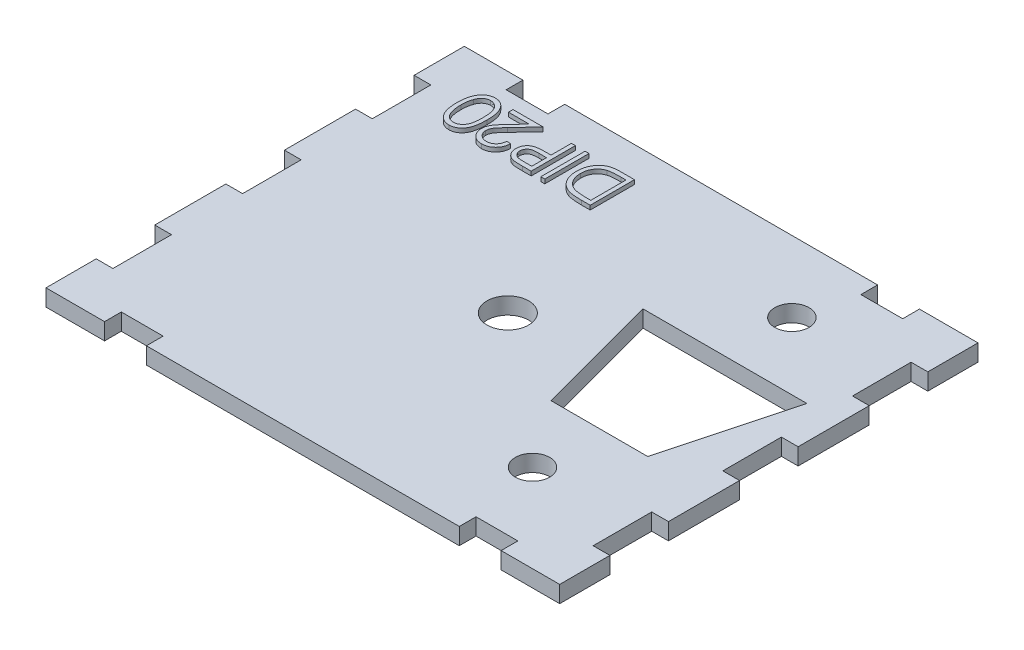
from build123d import *

# Parameters (mm, degrees)
SKETCH2_W           = 100
SKETCH2_H           = 50
BOSS_EXTRUDE1_DEPTH = 2
SKETCH12_W          = 9.8
SKETCH12_H          = 50
SKETCH12_W_2        = 8.8
CUT_EXTRUDE8_DEPTH  = 6
SKETCH13_W          = 2
SKETCH13_H          = 7
SKETCH13_W_2        = 5
SKETCH13_H_2        = 2
CUT_EXTRUDE10_DEPTH = 6
SKETCH15_W          = 6.543059906
SKETCH15_H          = 1
CUT_EXTRUDE13_DEPTH = 10
SKETCH16_R          = 2.5
CUT_EXTRUDE14_DEPTH = 10
SKETCH17_R          = 2.05
CUT_EXTRUDE15_DEPTH = 3.5
SKETCH22_W          = 0.474893162
SKETCH22_H          = 5.291666666
BOSS_EXTRUDE4_DEPTH = 0.5


with BuildPart() as part:
    # Sketch2 → Boss-Extrude1 (new body)
    with BuildSketch(Plane(origin=(0, 0, 0), x_dir=(1, 0, 0), z_dir=(0, 1, 0))):
        Rectangle(SKETCH2_W, SKETCH2_H)
    extrude(amount=BOSS_EXTRUDE1_DEPTH)

    # Sketch12 → Cut-Extrude8 (cut)
    with BuildSketch(Plane(origin=(0, 2, 0), x_dir=(1, 0, 0), z_dir=(0, 1, 0))):
        with Locations((-45.1, 0)):
            Rectangle(SKETCH12_W, SKETCH12_H)
        with Locations((45.6, 0)):
            Rectangle(SKETCH12_W_2, SKETCH12_H)
    extrude(amount=-CUT_EXTRUDE8_DEPTH, mode=Mode.SUBTRACT)

    # Sketch13 → Cut-Extrude10 (cut)
    with BuildSketch(Plane(origin=(0, 2, 0), x_dir=(1, 0, 0), z_dir=(0, 1, 0))):
        with Locations((-29.2, 0)):
            Rectangle(SKETCH13_W, SKETCH13_H)
        Polygon((-30.2, 12), (-30.2, 19), (-30.2, 25), (-40.2, 25), (-40.2, -25), (-30.2, -25), (-30.2, -19), (-30.2, -12), (-30.2, -3.5), (-30.2, 3.5), align=None)
        with Locations((-29.2, 15.5)):
            Rectangle(SKETCH13_W, SKETCH13_H)
        with Locations((21.7, -24)):
            Rectangle(SKETCH13_W_2, SKETCH13_H_2)
        with Locations((30.2, -15.5)):
            Rectangle(SKETCH13_W, SKETCH13_H)
        with Locations((30.2, 0)):
            Rectangle(SKETCH13_W, SKETCH13_H)
        with Locations((30.2, 15.5)):
            Rectangle(SKETCH13_W, SKETCH13_H)
        with Locations((21.7, 24)):
            Rectangle(SKETCH13_W_2, SKETCH13_H_2)
        with Locations((-29.2, -15.5)):
            Rectangle(SKETCH13_W, SKETCH13_H)
        Polygon((41.2, 25), (31.2, 25), (31.2, 19), (31.2, 12), (31.2, 3.5), (31.2, -3.5), (31.2, -12), (31.2, -19), (31.2, -25), (41.2, -25), align=None)
        with Locations((-20.7, 24)):
            Rectangle(SKETCH13_W_2, SKETCH13_H_2)
        with Locations((-20.7, -24)):
            Rectangle(SKETCH13_W_2, SKETCH13_H_2)
    extrude(amount=-CUT_EXTRUDE10_DEPTH, mode=Mode.SUBTRACT)

    # Sketch15 → Cut-Extrude13 (cut)
    with BuildSketch(Plane.XZ):
        Polygon((8.96933351, -7.5), (14.181143059, -7.5), (20.724202965, -7.5), (25.936012514, -7.5), (22.452673012, 5.5), (12.452673012, 5.5), align=None)
        Polygon((27.239237886, -8.5), (20.724202965, -8.5), (20.724202965, -7.5), (25.936012514, -7.5), (22.452673012, 5.5), (12.452673012, 5.5), (8.96933351, -7.5), (14.181143059, -7.5), (14.181143059, -8.5), (7.666108138, -8.5), (11.685346024, 6.5), (23.22, 6.5), align=None)
        with Locations((17.452673012, -8)):
            Rectangle(SKETCH15_W, SKETCH15_H)
    extrude(amount=-CUT_EXTRUDE13_DEPTH, mode=Mode.SUBTRACT)

    # Sketch16 → Cut-Extrude14 (cut)
    with BuildSketch(Plane(origin=(0, 0, 0), x_dir=(-1, 0, 0), z_dir=(0, -1, 0))):
        with Locations(Location((0, 0, 0), (0, 0, 90))):
            Circle(SKETCH16_R)
    extrude(amount=-CUT_EXTRUDE14_DEPTH, mode=Mode.SUBTRACT)

    # Sketch17 → Cut-Extrude15 (cut)
    with BuildSketch(Plane(origin=(0, 0, 0), x_dir=(-1, 0, 0), z_dir=(0, -1, 0))):
        with Locations(Location((-17.452672874, -14.5, 0), (0, 0, 90))):
            Circle(SKETCH17_R)
        with Locations(Location((-17.452672903, 16.5, 0), (0, 0, 90))):
            Circle(SKETCH17_R)
    extrude(amount=-CUT_EXTRUDE15_DEPTH, mode=Mode.SUBTRACT)

    # Sketch22 → Boss-Extrude4 (add)
    # profile 1 of 5: a face of its own
    with BuildSketch(Plane(origin=(0, 2, 0), x_dir=(1, 0, 0), z_dir=(0, 1, 0))):
        with BuildLine():
            add(Edge.make_bspline(
                [(-20.716744497, 18.218426666), (-20.717240429, 18.133612758), (-20.718203785, 17.96886052), (-20.728920802, 17.728793264), (-20.746723997, 17.503579492), (-20.771122173, 17.293208433), (-20.800812912, 17.097625749), (-20.840448286, 16.917354204), (-20.88552222, 16.751559148), (-20.937762848, 16.599700925), (-20.996706535, 16.45973023), (-21.060870631, 16.329070697), (-21.132757353, 16.207878408), (-21.208413198, 16.094367743), (-21.290485981, 15.989681037), (-21.378690291, 15.894288773), (-21.47224922, 15.806712705), (-21.571605461, 15.728392909), (-21.675812025, 15.660147655), (-21.781786347, 15.598284876), (-21.892551031, 15.549349711), (-22.005374005, 15.507504508), (-22.12116426, 15.474357453), (-22.239972236, 15.451301074), (-22.361904547, 15.436876513), (-22.444198293, 15.43549178), (-22.485933533, 15.434789513)],
                knots=[0, 0, 0, 0, 1.64625301, 3.197870201, 4.6634513, 6.030635694, 7.308242971, 8.501545196, 9.611429483, 10.641742253, 11.616230371, 12.55791849, 13.464870342, 14.34944951, 15.20427819, 16.044004467, 16.869007726, 17.689551165, 18.496129964, 19.285613293, 20.0683943, 20.843080271, 21.620342827, 22.403213977, 23.190190624, 24, 24, 24, 24], degree=3))
            add(Edge.make_bspline(
                [(-22.485933533, 15.434789513), (-22.528038535, 15.435373486), (-22.61181267, 15.436535387), (-22.73522212, 15.45288984), (-22.856481988, 15.473999006), (-22.973752523, 15.507854633), (-23.089251084, 15.548367281), (-23.200105454, 15.601823076), (-23.310229379, 15.659960405), (-23.414620076, 15.730883055), (-23.516396548, 15.809264255), (-23.611801364, 15.898246955), (-23.703273327, 15.995368549), (-23.787357576, 16.102795134), (-23.867657845, 16.21887954), (-23.941125855, 16.34459489), (-24.009289607, 16.47966258), (-24.073430397, 16.623456458), (-24.129519825, 16.77981748), (-24.179387809, 16.947770381), (-24.220263061, 17.128836057), (-24.254066175, 17.322005856), (-24.280303826, 17.528236739), (-24.299399145, 17.747110858), (-24.309489362, 17.978765144), (-24.311389212, 18.137149085), (-24.312364155, 18.218426666)],
                knots=[0, 0, 0, 0, 0.810910589, 1.61342667, 2.396193133, 3.181089899, 3.963115317, 4.752255436, 5.550715454, 6.36105385, 7.181178335, 8.024612154, 8.872680183, 9.750181803, 10.651284446, 11.591556747, 12.554036451, 13.566402641, 14.62422919, 15.753422176, 16.94128843, 18.199818041, 19.531985927, 20.947085226, 22.433341622, 24, 24, 24, 24], degree=3))
            add(Edge.make_bspline(
                [(-24.312364155, 18.218426666), (-24.311366549, 18.299348707), (-24.309418403, 18.45737495), (-24.299628784, 18.688001941), (-24.279791944, 18.905681719), (-24.255614422, 19.110729663), (-24.220755165, 19.30287774), (-24.181946396, 19.483157858), (-24.132443633, 19.64987607), (-24.077684634, 19.804896801), (-24.014436319, 19.948081555), (-23.946785923, 20.08259173), (-23.872221202, 20.207593617), (-23.793461748, 20.324413826), (-23.707785617, 20.430919093), (-23.617551542, 20.52912711), (-23.521221151, 20.618264406), (-23.41892076, 20.697571076), (-23.313543383, 20.769027981), (-23.203397989, 20.82923831), (-23.091062981, 20.88172943), (-22.975369929, 20.923926152), (-22.857056574, 20.957282826), (-22.73569685, 20.97999021), (-22.611796166, 20.995996057), (-22.528033014, 20.997212377), (-22.485933533, 20.997823701)],
                knots=[0, 0, 0, 0, 1.561431216, 3.049195289, 4.452146966, 5.778046447, 7.031138842, 8.218704273, 9.334037798, 10.384210803, 11.388620812, 12.352076869, 13.287433199, 14.19507451, 15.06813243, 15.922055533, 16.766344942, 17.596869952, 18.417486629, 19.220035357, 20.016159057, 20.807716045, 21.59340902, 22.384936649, 23.188266813, 24, 24, 24, 24], degree=3))
            add(Edge.make_bspline(
                [(-22.485933533, 20.997823701), (-22.444199748, 20.99711521), (-22.361908869, 20.995718204), (-22.239955549, 20.981383542), (-22.121319838, 20.958008536), (-22.005764569, 20.926265399), (-21.893053284, 20.885921737), (-21.784289992, 20.834606155), (-21.678038718, 20.775087836), (-21.574782726, 20.707375471), (-21.476495962, 20.629775573), (-21.382592523, 20.543964833), (-21.295530267, 20.447731815), (-21.21402349, 20.342612472), (-21.137739906, 20.228816063), (-21.066157605, 20.106695981), (-21.002188911, 19.974763601), (-20.941908745, 19.834033066), (-20.888771319, 19.681059028), (-20.842372699, 19.514695816), (-20.803254441, 19.333808679), (-20.772096202, 19.138388958), (-20.746570656, 18.928739176), (-20.728938353, 18.704525245), (-20.718209143, 18.466227411), (-20.717241621, 18.302534227), (-20.716744497, 18.218426666)],
                knots=[0, 0, 0, 0, 0.810976328, 1.599087026, 2.383086309, 3.159618043, 3.926613167, 4.707144544, 5.494386734, 6.292609454, 7.104690378, 7.92621526, 8.762510248, 9.62398222, 10.509836085, 11.424023232, 12.373226806, 13.358118208, 14.398657954, 15.5185989, 16.713620699, 17.994156382, 19.364120462, 20.818119981, 22.365111093, 24, 24, 24, 24], degree=3))
        make_face()
        with BuildLine():
            add(Edge.make_bspline(
                [(-21.191637659, 18.216306607), (-21.191822212, 18.286985905), (-21.192180392, 18.424160543), (-21.2012668, 18.623146598), (-21.213914152, 18.809052726), (-21.229825254, 18.981806364), (-21.253654372, 19.140803765), (-21.280690025, 19.286705867), (-21.313117431, 19.419242842), (-21.351674753, 19.53957213), (-21.395592975, 19.649400261), (-21.443467732, 19.751645476), (-21.495326441, 19.847551436), (-21.552358895, 19.936772111), (-21.615382206, 20.018809184), (-21.682989671, 20.094052275), (-21.755574408, 20.162195015), (-21.856031538, 20.243066641), (-21.988008519, 20.327620836), (-22.155144168, 20.40034548), (-22.326959281, 20.446343687), (-22.443609989, 20.452177047), (-22.501833973, 20.455088658)],
                knots=[0, 0, 0, 0, 1.459193451, 2.832007961, 4.111736495, 5.306635028, 6.412683014, 7.430020708, 8.369596877, 9.227877302, 10.036669781, 10.810175692, 11.557788084, 12.286326232, 12.994037279, 13.69140682, 14.37267704, 15.047194847, 16.352618509, 17.594157723, 18.799169539, 20, 20, 20, 20], degree=3))
            add(Edge.make_bspline(
                [(-22.501833973, 20.455088658), (-22.56039229, 20.452535574), (-22.677301204, 20.447438463), (-22.848999369, 20.402952882), (-23.014305724, 20.330633455), (-23.144763746, 20.248010224), (-23.243738474, 20.168821653), (-23.314678398, 20.101383625), (-23.379782473, 20.025850922), (-23.441532256, 19.944361484), (-23.498166684, 19.855351571), (-23.549666941, 19.759251103), (-23.596661992, 19.655792677), (-23.623436384, 19.583569385), (-23.63712544, 19.546643479)],
                knots=[0, 0, 0, 0, 1.353621445, 2.702441307, 4.075953605, 5.516772412, 6.261413105, 7.007624062, 7.778524365, 8.566925914, 9.372323995, 10.217594641, 11.088702136, 12, 12, 12, 12], degree=3))
            add(Edge.make_bspline(
                [(-23.63712544, 19.546643479), (-23.653078708, 19.499427087), (-23.685470683, 19.403557563), (-23.727217056, 19.254841089), (-23.760094029, 19.098808339), (-23.789671975, 18.936391793), (-23.809860524, 18.766393674), (-23.826110194, 18.589339974), (-23.83568159, 18.4050972), (-23.836868058, 18.279919059), (-23.837470993, 18.216306607)],
                knots=[0, 0, 0, 0, 0.884706709, 1.796334032, 2.740027952, 3.714592787, 4.726048262, 5.777819803, 6.87074269, 8, 8, 8, 8], degree=3))
            add(Edge.make_bspline(
                [(-23.837470993, 18.216306607), (-23.836806021, 18.152695522), (-23.835505032, 18.028243249), (-23.826957421, 17.846169461), (-23.81322212, 17.672936408), (-23.794631691, 17.50838694), (-23.769110968, 17.35281393), (-23.738463103, 17.205994778), (-23.702532053, 17.06796899), (-23.661317876, 16.938380859), (-23.614870734, 16.817695303), (-23.563558283, 16.705652528), (-23.508808846, 16.601648234), (-23.449303872, 16.506016944), (-23.385885258, 16.418200644), (-23.316275862, 16.340220811), (-23.244897219, 16.268283944), (-23.143381683, 16.187637415), (-23.01156069, 16.104759791), (-22.846399369, 16.030565501), (-22.675464524, 15.986655318), (-22.559669092, 15.980565949), (-22.501833973, 15.977524556)],
                knots=[0, 0, 0, 0, 1.313528337, 2.569860077, 3.762944266, 4.901481389, 5.988248151, 7.017139294, 7.997571128, 8.932104357, 9.823695246, 10.66607014, 11.475539426, 12.248954257, 12.990316782, 13.708962568, 14.405488541, 15.08007697, 16.381737273, 17.610043218, 18.806313575, 20, 20, 20, 20], degree=3))
            add(Edge.make_bspline(
                [(-22.501833973, 15.977524556), (-22.443295893, 15.980569547), (-22.326113091, 15.986665078), (-22.153390072, 16.030410579), (-21.987240021, 16.104232098), (-21.855696818, 16.1877399), (-21.755610415, 16.267970747), (-21.684387143, 16.336446079), (-21.617170962, 16.41098549), (-21.554449567, 16.492650604), (-21.497765085, 16.581701152), (-21.445276081, 16.676911849), (-21.397783283, 16.779005182), (-21.353699287, 16.888772612), (-21.31555108, 17.009299623), (-21.281251394, 17.141810167), (-21.254777198, 17.288661133), (-21.231270439, 17.448405185), (-21.213502001, 17.621364216), (-21.201354945, 17.807710428), (-21.192152794, 18.007390135), (-21.19181281, 18.145273012), (-21.191637659, 18.216306607)],
                knots=[0, 0, 0, 0, 1.207779899, 2.417760083, 3.652287919, 4.947299644, 5.621638849, 6.297435916, 6.984320042, 7.691843698, 8.42018894, 9.161205785, 9.934506883, 10.743085206, 11.601138371, 12.542248028, 13.566483018, 14.679455109, 15.87477181, 17.154161492, 18.533899613, 20, 20, 20, 20], degree=3))
        make_face(mode=Mode.SUBTRACT)
    # profile 2 of 5: a face of its own
    with BuildSketch(Plane(origin=(0, 2, 0), x_dir=(1, 0, 0), z_dir=(0, 1, 0))):
        with BuildLine():
            Line((-17.32465048, 17.198678402), (-16.849757317, 17.198678402))
            add(Edge.make_bspline(
                [(-16.849757317, 17.198678402), (-16.852851891, 17.135675678), (-16.858929551, 17.011940004), (-16.887403586, 16.831538016), (-16.928108647, 16.659082118), (-16.985797214, 16.496050803), (-17.057037554, 16.340496525), (-17.144256345, 16.194484864), (-17.245594226, 16.056566672), (-17.360865287, 15.929353198), (-17.485945012, 15.813064177), (-17.620083979, 15.711579967), (-17.761903493, 15.626816763), (-17.910173472, 15.555571335), (-18.066608702, 15.502157924), (-18.229713838, 15.462508642), (-18.400226098, 15.438657581), (-18.516400763, 15.436093539), (-18.575485149, 15.434789513)],
                knots=[0, 0, 0, 0, 1.100776268, 2.161895295, 3.184016182, 4.190939212, 5.176500551, 6.166955529, 7.155448256, 8.160289653, 9.16017456, 10.133824356, 11.091467644, 12.04088621, 13.000931625, 13.972173743, 14.968683325, 16, 16, 16, 16], degree=3))
            add(Edge.make_bspline(
                [(-18.575485149, 15.434789513), (-18.633513225, 15.43613687), (-18.747536322, 15.438784379), (-18.91388184, 15.461862354), (-19.072615359, 15.497227293), (-19.221937953, 15.549632562), (-19.363382093, 15.615389712), (-19.495196463, 15.697167342), (-19.620568474, 15.791096012), (-19.733345086, 15.901889483), (-19.836944009, 16.020106397), (-19.926240018, 16.146361068), (-20.003142442, 16.276912284), (-20.066084675, 16.412779842), (-20.113797686, 16.554406192), (-20.149148455, 16.700433513), (-20.169356865, 16.852547061), (-20.172441304, 16.955520649), (-20.174009454, 17.007873113)],
                knots=[0, 0, 0, 0, 1.111674182, 2.184400057, 3.212814286, 4.223731311, 5.211378316, 6.196328225, 7.191884489, 8.207283132, 9.220262353, 10.201199469, 11.166417575, 12.120932471, 13.06540007, 14.026332106, 14.996573967, 16, 16, 16, 16], degree=3))
            add(Edge.make_bspline(
                [(-20.174009454, 17.007873113), (-20.171449362, 17.081575165), (-20.166374103, 17.227685901), (-20.12296129, 17.442399313), (-20.055155392, 17.650425689), (-19.973523766, 17.817855649), (-19.891150425, 17.952755421), (-19.816994329, 18.063880067), (-19.729688646, 18.183499948), (-19.629979277, 18.312099225), (-19.516149085, 18.44799378), (-19.391155364, 18.593956229), (-19.251770107, 18.747287624), (-19.154027533, 18.85208326), (-19.10337978, 18.906385733)],
                knots=[0, 0, 0, 0, 1.184416499, 2.348048165, 3.509039915, 4.696071444, 5.333504901, 6.05069495, 6.844171097, 7.714965912, 8.667477798, 9.695072654, 10.805644396, 12, 12, 12, 12], degree=3))
            Line((-19.10337978, 18.906385733), (-17.779403084, 20.319404897))
            Line((-17.779403084, 20.319404897), (-20.241851335, 20.319404897))
            Line((-20.241851335, 20.319404897), (-20.241851335, 20.86213994))
            Line((-20.241851335, 20.86213994), (-16.646231676, 20.86213994))
            Line((-16.646231676, 20.86213994), (-18.698448557, 18.67211924))
            add(Edge.make_bspline(
                [(-18.698448557, 18.67211924), (-18.748417352, 18.619963931), (-18.84439718, 18.519784256), (-18.980093345, 18.373480687), (-19.102166364, 18.237912214), (-19.210697214, 18.112478104), (-19.305775196, 17.997889449), (-19.387096101, 17.893248245), (-19.455019352, 17.799452493), (-19.527003845, 17.689265166), (-19.595645836, 17.554573304), (-19.655975122, 17.390800765), (-19.692497651, 17.221836952), (-19.696901246, 17.107690788), (-19.699116292, 17.050274288)],
                knots=[0, 0, 0, 0, 1.329530082, 2.553755191, 3.672934919, 4.687409497, 5.60679272, 6.413407421, 7.126401618, 7.737995624, 8.834647426, 9.90044882, 10.943907757, 12, 12, 12, 12], degree=3))
            add(Edge.make_bspline(
                [(-19.699116292, 17.050274288), (-19.698164983, 17.014163899), (-19.696290137, 16.942997254), (-19.679430288, 16.838724367), (-19.654659824, 16.737751005), (-19.616480887, 16.641325632), (-19.5706103, 16.547551747), (-19.512007243, 16.459280369), (-19.445039337, 16.373502538), (-19.367359852, 16.293159506), (-19.28208221, 16.219552812), (-19.191978454, 16.154354698), (-19.096653465, 16.099866631), (-18.996504504, 16.055199774), (-18.891812005, 16.020160778), (-18.782373149, 15.995881743), (-18.668490414, 15.980637985), (-18.590727867, 15.978575488), (-18.551104473, 15.977524556)],
                knots=[0, 0, 0, 0, 0.991504627, 1.954065223, 2.895985987, 3.842598665, 4.797835564, 5.759220273, 6.74786863, 7.784730864, 8.824135544, 9.839918996, 10.835834653, 11.835434876, 12.84861661, 13.863796685, 14.911511676, 16, 16, 16, 16], degree=3))
            add(Edge.make_bspline(
                [(-18.551104473, 15.977524556), (-18.50971181, 15.978562631), (-18.428423454, 15.980601241), (-18.309330619, 15.996052214), (-18.194924754, 16.019451925), (-18.086968824, 16.056704074), (-17.983203502, 16.100302847), (-17.886275893, 16.15675559), (-17.79346318, 16.221261578), (-17.706631391, 16.296471463), (-17.627546394, 16.381372095), (-17.555602065, 16.473784933), (-17.494642922, 16.575348268), (-17.440530105, 16.683625061), (-17.399144484, 16.801590119), (-17.363762743, 16.926358466), (-17.33806196, 17.059710251), (-17.329195224, 17.151586311), (-17.32465048, 17.198678402)],
                knots=[0, 0, 0, 0, 1.031072318, 2.024855787, 2.988461151, 3.935103592, 4.865765533, 5.788564469, 6.724086513, 7.67908574, 8.64457978, 9.611397706, 10.591395687, 11.591555111, 12.622101007, 13.700900657, 14.821571223, 16, 16, 16, 16], degree=3))
        make_face()
    # profile 3 of 5: a face of its own
    with BuildSketch(Plane(origin=(0, 2, 0), x_dir=(1, 0, 0), z_dir=(0, 1, 0))):
        with BuildLine():
            Line((-12.779244497, 15.570473274), (-13.81701326, 15.570473274))
            add(Edge.make_bspline(
                [(-13.81701326, 15.570473274), (-13.888391654, 15.570551736), (-14.025155827, 15.570702073), (-14.221272637, 15.575260081), (-14.399389731, 15.581348056), (-14.559123045, 15.589787347), (-14.700964051, 15.599760763), (-14.82427092, 15.613748966), (-14.930012869, 15.628354413), (-14.993371429, 15.643203444), (-15.022266666, 15.649975477)],
                knots=[0, 0, 0, 0, 1.415646017, 2.712440637, 3.8905458, 4.950247383, 5.884950622, 6.709939814, 7.411656543, 8, 8, 8, 8], degree=3))
            add(Edge.make_bspline(
                [(-15.022266666, 15.649975477), (-15.058844752, 15.659987537), (-15.131139009, 15.679775734), (-15.235314186, 15.719404017), (-15.334412874, 15.766413516), (-15.428849594, 15.819911156), (-15.517006538, 15.882423347), (-15.601636135, 15.950342098), (-15.68096358, 16.026414205), (-15.753791054, 16.110539513), (-15.821268853, 16.199962107), (-15.877752607, 16.296962218), (-15.927629985, 16.398174872), (-15.966499879, 16.506071206), (-15.99705311, 16.619227004), (-16.019305061, 16.737936774), (-16.033606865, 16.861944432), (-16.034963926, 16.946704527), (-16.035654753, 16.989852614)],
                knots=[0, 0, 0, 0, 0.999333726, 1.975119402, 2.933498163, 3.889020618, 4.832249799, 5.779334906, 6.747801194, 7.724875447, 8.710438469, 9.696133548, 10.679360639, 11.681339199, 12.714023775, 13.766351759, 14.862936069, 16, 16, 16, 16], degree=3))
            add(Edge.make_bspline(
                [(-16.035654753, 16.989852614), (-16.035017599, 17.033361872), (-16.033770964, 17.118490673), (-16.018808723, 17.243030484), (-15.998654743, 17.362045193), (-15.967665152, 17.475270909), (-15.927077051, 17.582035229), (-15.879464067, 17.683969711), (-15.822036586, 17.779340167), (-15.75604976, 17.868492833), (-15.682644374, 17.951511391), (-15.602131003, 18.027794235), (-15.514834691, 18.096894842), (-15.421032872, 18.158968123), (-15.319811077, 18.212574641), (-15.212704488, 18.260588662), (-15.098782137, 18.300912765), (-15.019947622, 18.322124882), (-14.979865491, 18.332909839)],
                knots=[0, 0, 0, 0, 1.121902311, 2.195077645, 3.232258892, 4.234102512, 5.217864754, 6.176164875, 7.132989551, 8.084763148, 9.034132444, 9.988522005, 10.94243251, 11.903244335, 12.886203696, 13.894208494, 14.929344452, 16, 16, 16, 16], degree=3))
            add(Edge.make_bspline(
                [(-14.979865491, 18.332909839), (-14.946713072, 18.339954568), (-14.87405762, 18.355393501), (-14.754408864, 18.37274643), (-14.615031471, 18.386977728), (-14.456399664, 18.400258489), (-14.278143518, 18.407295632), (-14.080671866, 18.415558386), (-13.863316399, 18.419457128), (-13.711717737, 18.419703577), (-13.632568148, 18.419832248)],
                knots=[0, 0, 0, 0, 0.601372724, 1.317943291, 2.144091499, 3.08771165, 4.142394186, 5.309582461, 6.595334295, 8, 8, 8, 8], degree=3))
            Line((-13.632568148, 18.419832248), (-13.254137659, 18.419832248))
            Line((-13.254137659, 18.419832248), (-13.254137659, 20.86213994))
            Line((-13.254137659, 20.86213994), (-12.779244497, 20.86213994))
            Line((-12.779244497, 20.86213994), (-12.779244497, 15.570473274))
        make_face()
        with BuildLine():
            Line((-13.254137659, 16.113208316), (-13.254137659, 17.877097205))
            Line((-13.254137659, 17.877097205), (-14.180603338, 17.888757528))
            add(Edge.make_bspline(
                [(-14.180603338, 17.888757528), (-14.225840178, 17.888787356), (-14.313168964, 17.888844938), (-14.439658695, 17.88271634), (-14.556729458, 17.876049117), (-14.664554104, 17.865266634), (-14.762640492, 17.852115365), (-14.851226102, 17.834532053), (-14.931017891, 17.81659821), (-15.022929194, 17.785479811), (-15.125879494, 17.738533756), (-15.237617027, 17.66841397), (-15.333087585, 17.580080672), (-15.415005911, 17.479688961), (-15.479756752, 17.367889769), (-15.526684494, 17.248603261), (-15.555328213, 17.122282387), (-15.558928486, 17.03593638), (-15.560761591, 16.991972673)],
                knots=[0, 0, 0, 0, 1.160501667, 2.240324542, 3.248665471, 4.168823117, 5.020172044, 5.786515869, 6.485785279, 7.116517804, 8.272762037, 9.381837012, 10.485674779, 11.594342068, 12.695271952, 13.786226926, 14.872841088, 16, 16, 16, 16], degree=3))
            add(Edge.make_bspline(
                [(-15.560761591, 16.991972673), (-15.558846703, 16.949433268), (-15.555040144, 16.864870196), (-15.526921101, 16.740876728), (-15.479259773, 16.622946321), (-15.414953123, 16.512033242), (-15.334997849, 16.411908358), (-15.241426001, 16.325543685), (-15.135693414, 16.255641595), (-15.03810663, 16.209108439), (-14.950774144, 16.181820361), (-14.875283153, 16.16211975), (-14.789612426, 16.148532658), (-14.694572728, 16.135532366), (-14.590285742, 16.125038301), (-14.47608833, 16.117750887), (-14.352360878, 16.113530682), (-14.266469108, 16.113318373), (-14.221944484, 16.113208316)],
                knots=[0, 0, 0, 0, 1.12039168, 2.227199994, 3.330242575, 4.460839274, 5.593542475, 6.693949254, 7.801736126, 8.92216649, 9.528704869, 10.210659466, 10.975987387, 11.81211542, 12.738540127, 13.736887663, 14.826846554, 16, 16, 16, 16], degree=3))
            Line((-14.221944484, 16.113208316), (-13.254137659, 16.113208316))
        make_face(mode=Mode.SUBTRACT)
    # profile 4 of 5: a face of its own
    with BuildSketch(Plane(origin=(0, 2, 0), x_dir=(1, 0, 0), z_dir=(0, 1, 0))):
        with Locations((-11.38848595, 18.216306607)):
            Rectangle(SKETCH22_W, SKETCH22_H)
    # profile 5 of 5: a face of its own
    with BuildSketch(Plane(origin=(0, 2, 0), x_dir=(1, 0, 0), z_dir=(0, 1, 0))):
        with BuildLine():
            Line((-5.723688941, 20.86213994), (-5.723688941, 15.570473274))
            Line((-5.723688941, 15.570473274), (-6.792198557, 15.570473274))
            add(Edge.make_bspline(
                [(-6.792198557, 15.570473274), (-6.885134006, 15.571140574), (-7.06468481, 15.572429795), (-7.324143899, 15.580650845), (-7.563867423, 15.595047052), (-7.783719247, 15.616421321), (-7.98405258, 15.642076434), (-8.164546566, 15.674703333), (-8.325493708, 15.713074776), (-8.424477074, 15.745802175), (-8.471285095, 15.761278562)],
                knots=[0, 0, 0, 0, 1.314317071, 2.539253741, 3.67075822, 4.709970291, 5.662644612, 6.526156501, 7.303037452, 8, 8, 8, 8], degree=3))
            add(Edge.make_bspline(
                [(-8.471285095, 15.761278562), (-8.53251476, 15.78460108), (-8.653585603, 15.830717239), (-8.825874032, 15.917841975), (-8.988614406, 16.01615447), (-9.14052172, 16.127908689), (-9.281930695, 16.251676544), (-9.414620562, 16.386456655), (-9.534788012, 16.535847196), (-9.646577657, 16.695212634), (-9.7444226, 16.866003227), (-9.830703037, 17.044798063), (-9.904373432, 17.231250227), (-9.961856128, 17.426720174), (-10.009346768, 17.629330494), (-10.041211823, 17.840615192), (-10.062378498, 18.059342464), (-10.064495254, 18.207774813), (-10.065569283, 18.283088458)],
                knots=[0, 0, 0, 0, 0.984696416, 1.947063185, 2.89840987, 3.841051395, 4.778753227, 5.721858861, 6.681155121, 7.65838316, 8.646299769, 9.637283673, 10.641736726, 11.657050558, 12.698485921, 13.768600492, 14.86780186, 16, 16, 16, 16], degree=3))
            add(Edge.make_bspline(
                [(-10.065569283, 18.283088458), (-10.064617703, 18.348495109), (-10.062742514, 18.477385745), (-10.045925232, 18.667345988), (-10.02143462, 18.851656097), (-9.983691872, 19.029506784), (-9.937314458, 19.202095469), (-9.880072905, 19.368604968), (-9.812227131, 19.529148452), (-9.733545302, 19.682450768), (-9.64739191, 19.828139144), (-9.553513645, 19.963905237), (-9.455124841, 20.091245929), (-9.348637079, 20.207284453), (-9.237576061, 20.315634282), (-9.118164447, 20.411489008), (-8.994141156, 20.499298667), (-8.861780168, 20.57639663), (-8.719995512, 20.644977559), (-8.56508357, 20.702894566), (-8.397609727, 20.752736464), (-8.216464268, 20.792447078), (-8.022251331, 20.824455847), (-7.814444447, 20.845772044), (-7.59343275, 20.860227086), (-7.441668362, 20.861489941), (-7.363554393, 20.86213994)],
                knots=[0, 0, 0, 0, 1.105894396, 2.179280415, 3.222964075, 4.248423888, 5.251546139, 6.243661943, 7.223682738, 8.196462441, 9.155694589, 10.083899862, 10.986397372, 11.874737962, 12.745335529, 13.607670254, 14.461432187, 15.313100333, 16.195087267, 17.121790994, 18.106827133, 19.14775296, 20.255889161, 21.433815148, 22.679170477, 24, 24, 24, 24], degree=3))
            Line((-7.363554393, 20.86213994), (-5.723688941, 20.86213994))
        make_face()
        with BuildLine():
            Line((-6.198582104, 20.319404897), (-6.805978939, 20.319404897))
            add(Edge.make_bspline(
                [(-6.805978939, 20.319404897), (-6.893258737, 20.319029799), (-7.061129754, 20.318308348), (-7.30251744, 20.311977696), (-7.523073195, 20.301633338), (-7.722828334, 20.287156732), (-7.901670073, 20.268002993), (-8.059972171, 20.246647485), (-8.197215716, 20.220041815), (-8.280263794, 20.195925484), (-8.318640864, 20.184781166)],
                knots=[0, 0, 0, 0, 1.375205317, 2.645023457, 3.804390687, 4.853969522, 5.800190428, 6.637939096, 7.370582563, 8, 8, 8, 8], degree=3))
            add(Edge.make_bspline(
                [(-8.318640864, 20.184781166), (-8.366944772, 20.167771153), (-8.462398848, 20.134157409), (-8.599787552, 20.07281971), (-8.727986829, 20.000252482), (-8.849133895, 19.919112184), (-8.962450178, 19.828145931), (-9.067410918, 19.72706443), (-9.164845177, 19.617037922), (-9.253192938, 19.49769567), (-9.33309648, 19.370361835), (-9.402132876, 19.235178257), (-9.460329777, 19.092903538), (-9.508076465, 18.944032676), (-9.545302509, 18.788477067), (-9.571511109, 18.625846346), (-9.587752271, 18.456204737), (-9.589690878, 18.340720228), (-9.590676121, 18.282028428)],
                knots=[0, 0, 0, 0, 0.998420628, 1.972994, 2.929372424, 3.86770908, 4.81360496, 5.759023883, 6.706048443, 7.676227424, 8.651287839, 9.634325482, 10.632389399, 11.645655052, 12.680158286, 13.74837235, 14.855672678, 16, 16, 16, 16], degree=3))
            add(Edge.make_bspline(
                [(-9.590676121, 18.282028428), (-9.589899252, 18.220141275), (-9.588373087, 18.098563415), (-9.569222462, 17.920167468), (-9.541177148, 17.748614566), (-9.500836151, 17.583781197), (-9.448719061, 17.425881815), (-9.386356738, 17.274024356), (-9.31063909, 17.130163079), (-9.224918706, 16.993079534), (-9.128681877, 16.864849767), (-9.022355505, 16.746976056), (-8.907060737, 16.639238831), (-8.783328929, 16.541466557), (-8.649430104, 16.455397979), (-8.507630092, 16.378832716), (-8.355931452, 16.313778315), (-8.250379318, 16.279190191), (-8.196737486, 16.261612429)],
                knots=[0, 0, 0, 0, 1.122272916, 2.204715076, 3.251197285, 4.274229216, 5.279697671, 6.265416158, 7.248880903, 8.225321784, 9.195852973, 10.153576302, 11.101466393, 12.055578741, 13.010401466, 13.985536859, 14.976245305, 16, 16, 16, 16], degree=3))
            add(Edge.make_bspline(
                [(-8.196737486, 16.261612429), (-8.152361348, 16.249341164), (-8.058005503, 16.223249085), (-7.904033932, 16.194786915), (-7.730746742, 16.169682494), (-7.537374575, 16.148428077), (-7.324137857, 16.133177008), (-7.090872591, 16.121729901), (-6.83747795, 16.114009159), (-6.661821024, 16.113481947), (-6.570652416, 16.113208316)],
                knots=[0, 0, 0, 0, 0.674548936, 1.434276114, 2.292660221, 3.240891867, 4.284742987, 5.42552168, 6.663806718, 8, 8, 8, 8], degree=3))
            Line((-6.570652416, 16.113208316), (-6.198582104, 16.113208316))
            Line((-6.198582104, 16.113208316), (-6.198582104, 20.319404897))
        make_face(mode=Mode.SUBTRACT)
    extrude(amount=BOSS_EXTRUDE4_DEPTH)


solid = part.part
